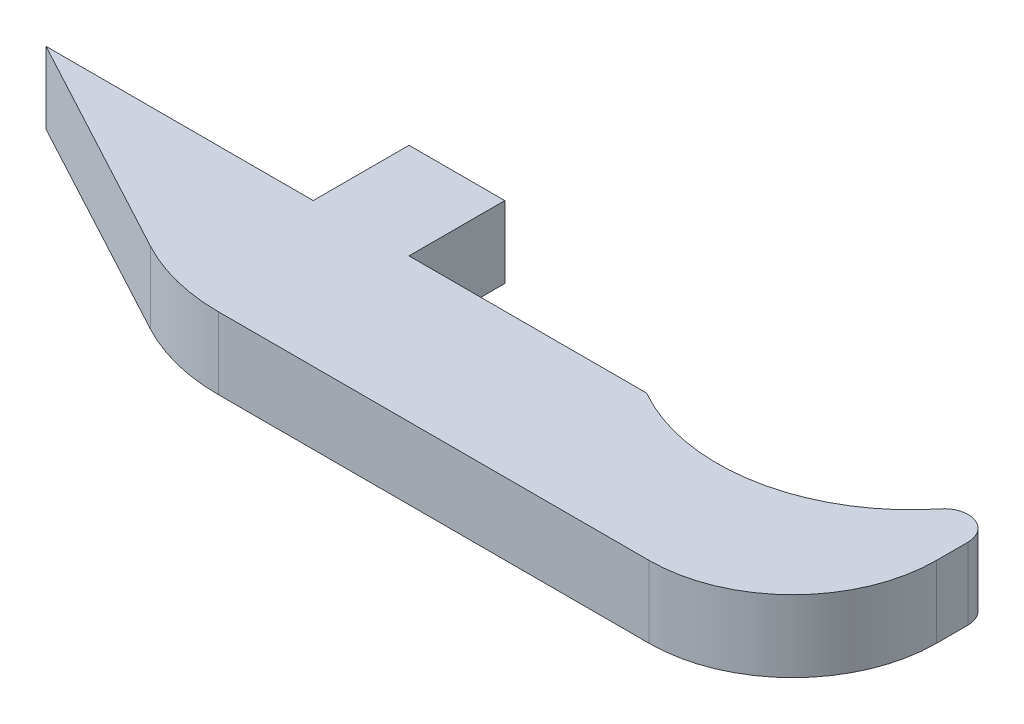
from build123d import *

# Parameters (mm, degrees)
BOSS_EXTRUDE1_DEPTH = 4.7625
FILLET1_R           = 9.525
FILLET2_R           = 1.5875
FILLET4_R           = 12.7
BOSS_EXTRUDE2_DEPTH = 4.7625


with BuildPart() as part:
    # Sketch1 → Boss-Extrude1 (new body)
    with BuildSketch(Plane(origin=(0, 0, 0), x_dir=(1, 0, 0), z_dir=(0, 1, 0))):
        with BuildLine():
            ThreePointArc((62.20459999999994, 11.1252), (55.80558311010998, 0.02506657124609291), (42.993098926305386, 3.1797e-13))
            Line((42.993098926305315, 3.26e-15), (3.17499999999972, 1.85e-15))
            Line((3.174999999999723, -3.02e-15), (20.929599999999944, -9.525))
            Line((20.929599999999944, -9.525), (62.20459999999994, -9.525))
            Line((62.20459999999994, -9.525), (62.20459999999994, 11.125200000000005))
        make_face()
    extrude(amount=BOSS_EXTRUDE1_DEPTH)

    # Fillet1
    fillet1_edges = [part.edges().sort_by_distance(p)[0] for p in [
        (62.20459999999994, 2.38125, 9.525),
    ]]
    fillet(fillet1_edges, radius=FILLET1_R)

    # Fillet2
    fillet2_edges = [part.edges().sort_by_distance(p)[0] for p in [
        (62.20459999999994, 2.38125, -11.125200000000003),
    ]]
    fillet(fillet2_edges, radius=FILLET2_R)

    # Fillet4
    fillet4_edges = [part.edges().sort_by_distance(p)[0] for p in [
        (20.929599999999944, 2.38125, 9.525),
    ]]
    fillet(fillet4_edges, radius=FILLET4_R)

    # Sketch2 → Boss-Extrude2 (add)
    with BuildSketch(Plane.XZ):
        Polygon((20.889500000000094, -6.349999999999998), (27.239500000000092, -6.349999999999998), (27.239500000000096, 5.33e-15), (20.889500000000094, 4.43e-15), align=None)
    extrude(amount=-BOSS_EXTRUDE2_DEPTH)


solid = part.part
